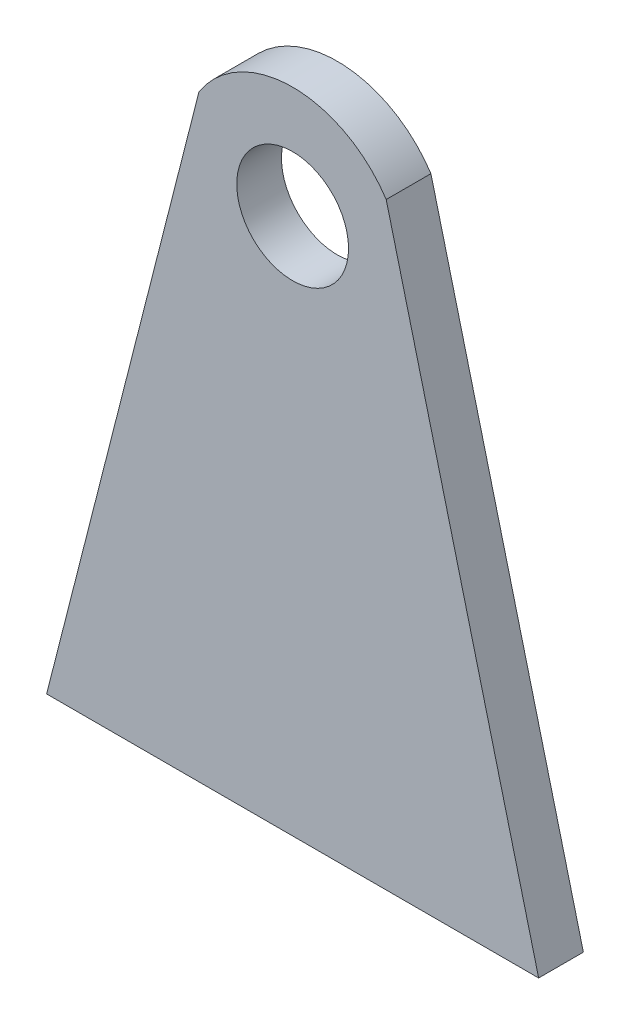
from build123d import *

# Parameters (mm, degrees)
BOSS_EXTRUDE1_DEPTH = 20
SKETCH3_R           = 25
CUT_EXTRUDE1_DEPTH  = 20


with BuildPart() as part:
    # Sketch2 → Boss-Extrude1 (new body)
    with BuildSketch(Plane.XY):
        with BuildLine():
            Line((110, -145), (-110, -145))
            Line((-110, -145), (-41.838080506, 122.37836773))
            ThreePointArc((-41.838080506, 122.37836773), (0, 145), (41.838080506, 122.37836773))
            Line((41.838080506, 122.37836773), (110, -145))
        make_face()
    extrude(amount=BOSS_EXTRUDE1_DEPTH)

    # Sketch3 → Cut-Extrude1 (cut)
    with BuildSketch(Plane.XY.offset(20)):
        with Locations((0, 95)):
            Circle(SKETCH3_R)
    extrude(amount=-CUT_EXTRUDE1_DEPTH, mode=Mode.SUBTRACT)


solid = part.part
